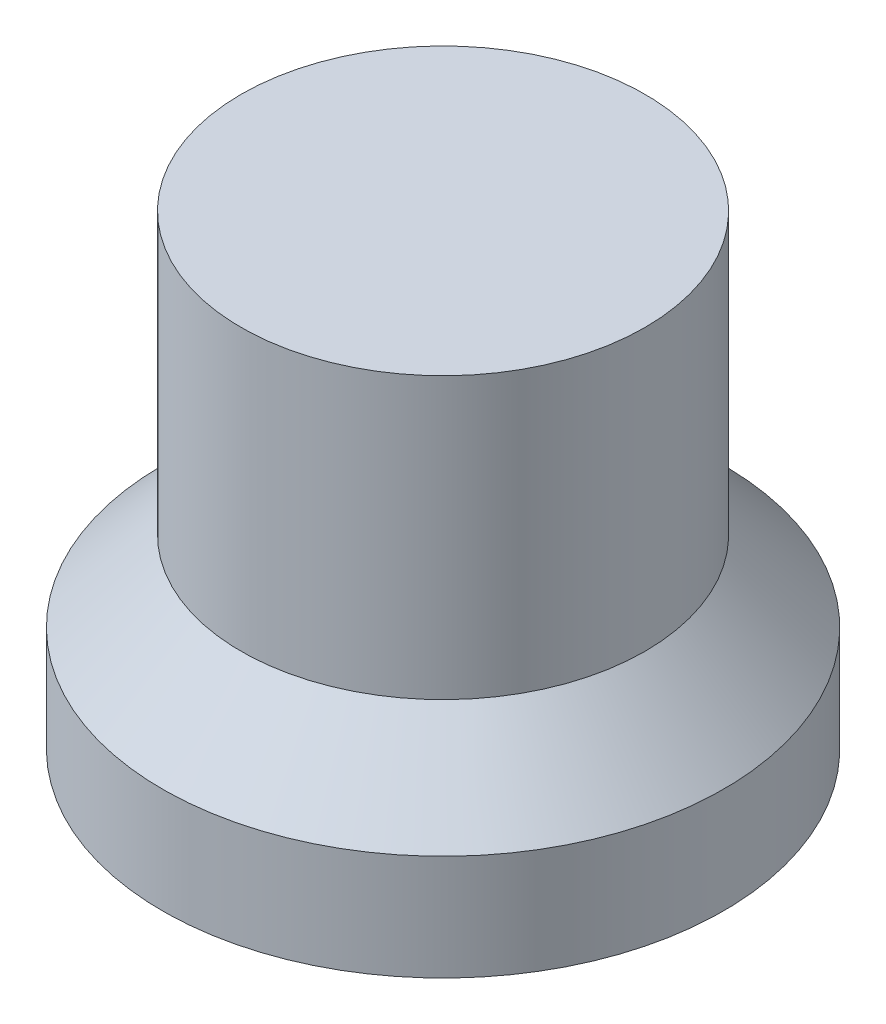
from build123d import *


with BuildPart() as part:
    # Croquis1 → Revolución1 (revolve)
    with BuildSketch(Plane.XY):
        Polygon((0, 0), (-9, 0), (-9, -12.5), (-12.5, -16.070714214), (-12.5, -20.770714214), (0, -20.770714214), align=None)
    revolve(axis=Axis((0, 0, 0), (0, -1, 0)))


solid = part.part
